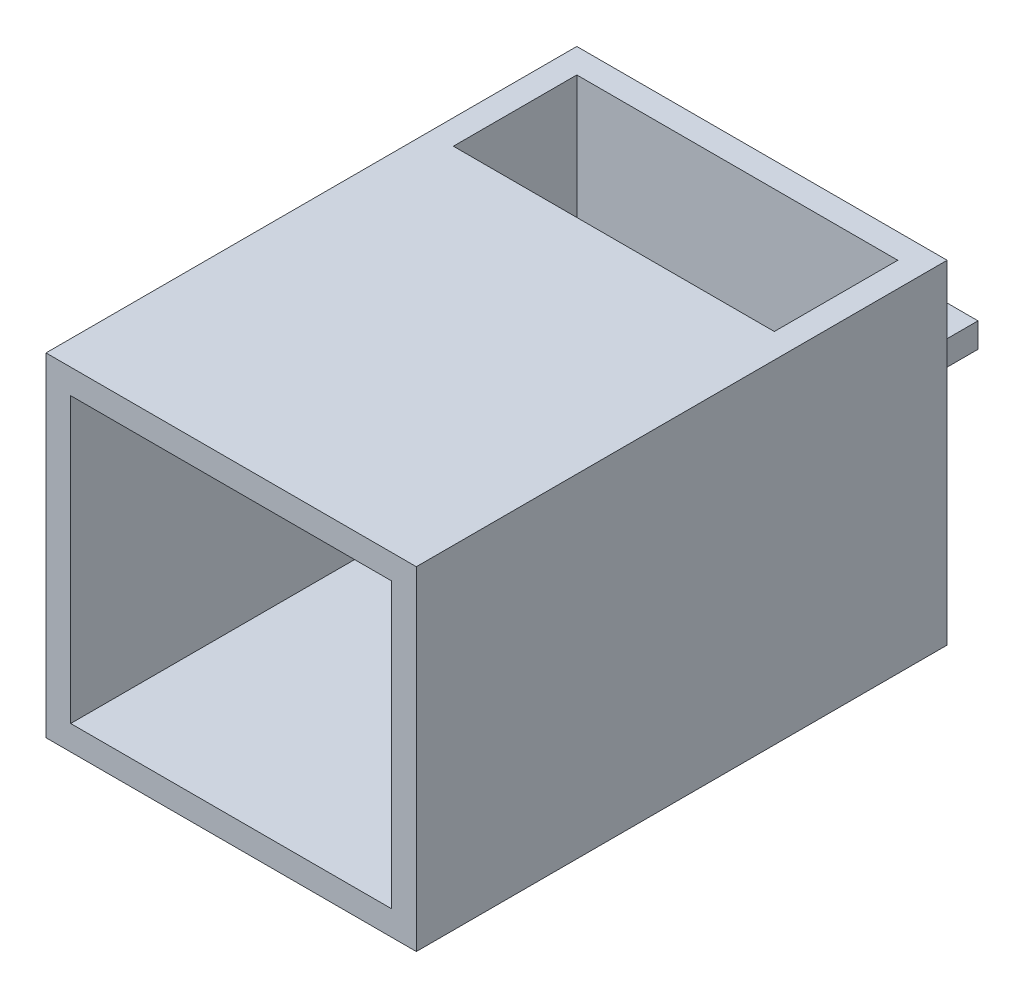
from build123d import *

# Parameters (mm, degrees)
SKETCH1_W           = 30
SKETCH1_H           = 27
SKETCH1_W_2         = 26
SKETCH1_H_2         = 23
BOSS_EXTRUDE1_DEPTH = 43
SKETCH3_W           = 30
SKETCH3_H           = 15
BOSS_EXTRUDE2_DEPTH = 2
SKETCH5_W           = 15
SKETCH5_H           = 2
SKETCH5_W_2         = 5
BOSS_EXTRUDE3_DEPTH = 10
BOSS_EXTRUDE4_DEPTH = 5
SKETCH7_W           = 5
SKETCH7_H           = 2
CUT_EXTRUDE1_DEPTH  = 5
FILLET3_R           = 0.5
SKETCH8_W           = 26
SKETCH8_H           = 10
CUT_EXTRUDE2_DEPTH  = 10


with BuildPart() as part:
    # Sketch1 → Boss-Extrude1 (new body)
    with BuildSketch(Plane.XY):
        Rectangle(SKETCH1_W, SKETCH1_H)
        Rectangle(SKETCH1_W_2, SKETCH1_H_2, mode=Mode.SUBTRACT)
    extrude(amount=BOSS_EXTRUDE1_DEPTH)

    # Sketch3 → Boss-Extrude2 (add)
    with BuildSketch(Plane(origin=(0, 0, 0), x_dir=(-1, 0, 0), z_dir=(0, 0, -1))):
        with Locations((0, 6)):
            Rectangle(SKETCH3_W, SKETCH3_H)
    extrude(amount=-BOSS_EXTRUDE2_DEPTH)

    # Sketch5 → Boss-Extrude3 (add)
    with BuildSketch(Plane(origin=(0, 0, 0), x_dir=(-1, 0, 0), z_dir=(0, 0, -1))):
        with Locations((0, -0.5)):
            Rectangle(SKETCH5_W, SKETCH5_H)
        with Locations((0, -12.5)):
            Rectangle(SKETCH5_W_2, SKETCH5_H)
    extrude(amount=BOSS_EXTRUDE3_DEPTH)

    # Sketch6 → Boss-Extrude4 (add)
    with BuildSketch(Plane.ZY.offset(2.5)):
        Polygon((-5, -13.5), (-3, -15.5), (-3, -13.5), align=None)
    extrude(amount=-BOSS_EXTRUDE4_DEPTH)

    # Sketch7 → Cut-Extrude1 (cut)
    with BuildSketch(Plane(origin=(0, 0, -10), x_dir=(-1, 0, 0), z_dir=(0, 0, -1))):
        with Locations((0, -12.5)):
            Rectangle(SKETCH7_W, SKETCH7_H)
    extrude(amount=-CUT_EXTRUDE1_DEPTH, mode=Mode.SUBTRACT)

    # Fillet3
    fillet3_edges = [part.edges().sort_by_distance(p)[0] for p in [
        (0, -13.5, -5),
        (0, -15.5, -3),
        (0, -11.5, -5),
    ]]
    fillet(fillet3_edges, radius=FILLET3_R)

    # Sketch8 → Cut-Extrude2 (cut)
    with BuildSketch(Plane(origin=(0, 13.5, 0), x_dir=(1, 0, 0), z_dir=(0, 1, 0))):
        with Locations((0, -7)):
            Rectangle(SKETCH8_W, SKETCH8_H)
    extrude(amount=-CUT_EXTRUDE2_DEPTH, mode=Mode.SUBTRACT)


solid = part.part
